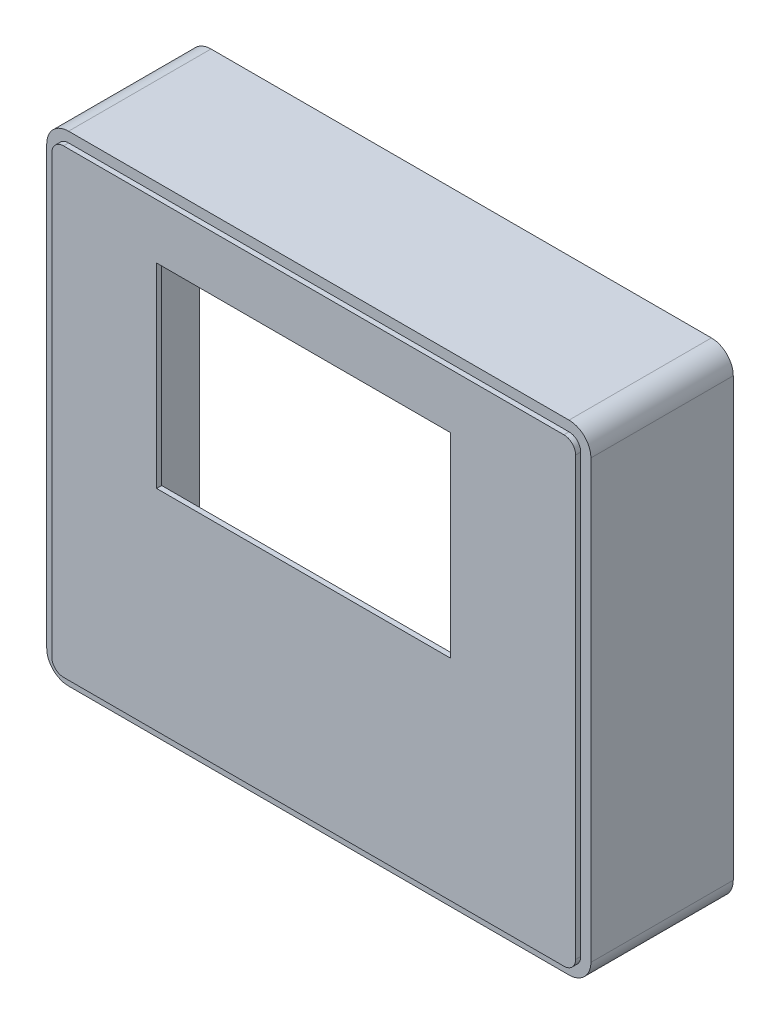
from build123d import *

# Parameters (mm, degrees)
BOSS_EXTRUDE1_DEPTH = 28
SKETCH3_W           = 57.8
SKETCH3_H           = 38.4
BOSS_EXTRUDE2_DEPTH = 28
SKETCH4_W           = 9.3
SKETCH4_H           = 11
SKETCH4_W_2         = 17.696
SKETCH4_H_2         = 6.81
SKETCH4_W_3         = 8.89
SKETCH4_H_3         = 3.43
SKETCH4_W_4         = 14.05
SKETCH4_H_4         = 16.84
CUT_EXTRUDE1_DEPTH  = 2
CUT_EXTRUDE2_DEPTH  = 23
SKETCH6_W           = 57.8
SKETCH6_H           = 38.4
CUT_EXTRUDE5_DEPTH  = 28
SKETCH7_W           = 57.8
SKETCH7_H           = 38.4
BOSS_EXTRUDE3_DEPTH = 28
CUT_EXTRUDE7_DEPTH  = 27


with BuildPart() as part:
    # Sketch2 → Boss-Extrude1 (new body)
    with BuildSketch(Plane.XY):
        with BuildLine():
            Line((-18.7, 47.45), (-18.7, -38.45))
            ThreePointArc((-18.7, -38.45), (-17.440559159, -41.490559159), (-14.4, -42.75))
            Line((-14.4, -42.75), (84, -42.75))
            ThreePointArc((84, -42.75), (87.040559159, -41.490559159), (88.3, -38.45))
            Line((88.3, -38.45), (88.3, 47.45))
            ThreePointArc((88.3, 47.45), (87.040559159, 50.490559159), (84, 51.75))
            Line((84, 51.75), (-14.4, 51.75))
            ThreePointArc((-14.4, 51.75), (-17.440559159, 50.490559159), (-18.7, 47.45))
        make_face()
        with BuildLine():
            Line((84, 49.75), (-14.4, 49.75))
            ThreePointArc((-14.4, 49.75), (-16.026345597, 49.076345597), (-16.7, 47.45))
            Line((-16.7, 47.45), (-16.7, -38.45))
            ThreePointArc((-16.7, -38.45), (-16.026345597, -40.076345597), (-14.4, -40.75))
            Line((-14.4, -40.75), (84, -40.75))
            ThreePointArc((84, -40.75), (85.626345597, -40.076345597), (86.3, -38.45))
            Line((86.3, -38.45), (86.3, 47.45))
            ThreePointArc((86.3, 47.45), (85.626345597, 49.076345597), (84, 49.75))
        make_face(mode=Mode.SUBTRACT)
    extrude(amount=BOSS_EXTRUDE1_DEPTH)

    # Sketch3 → Boss-Extrude2 (add)
    with BuildSketch(Plane.XY):
        with BuildLine():
            Line((-18.7, 47.45), (-18.7, -38.45))
            ThreePointArc((-18.7, -38.45), (-17.440559159, -41.490559159), (-14.4, -42.75))
            Line((-14.4, -42.75), (84, -42.75))
            ThreePointArc((84, -42.75), (87.040559159, -41.490559159), (88.3, -38.45))
            Line((88.3, -38.45), (88.3, 47.45))
            ThreePointArc((88.3, 47.45), (87.040559159, 50.490559159), (84, 51.75))
            Line((84, 51.75), (-14.4, 51.75))
            ThreePointArc((-14.4, 51.75), (-17.440559159, 50.490559159), (-18.7, 47.45))
        make_face()
        with Locations((32.8, 19.76)):
            Rectangle(SKETCH3_W, SKETCH3_H, mode=Mode.SUBTRACT)
    extrude(amount=BOSS_EXTRUDE2_DEPTH)

    # Sketch4 → Cut-Extrude1 (cut)
    with BuildSketch(Plane.XZ.offset(42.75)):
        with Locations((-9.2, 5.47)):
            Rectangle(SKETCH4_W, SKETCH4_H)
        with Locations((7.56, 3.4512)):
            Rectangle(SKETCH4_W_2, SKETCH4_H_2)
        with Locations((76.775, 1.7612)):
            Rectangle(SKETCH4_W_3, SKETCH4_H_3)
        Polygon((66.12, -0.03), (68.12, -0.03), (69.827, -0.03), (69.827, 13.619992795), (68.12, 13.619992795), (66.12, 13.619992795), (57.38, 13.619992795), (55.38, 13.619992795), (53.673, 13.619992795), (53.673, -0.03), (55.38, -0.03), (57.38, -0.03), align=None)
        with Locations((44.4, 8.4662)):
            Rectangle(SKETCH4_W_4, SKETCH4_H_4)
        with Locations((27.4, 8.4662)):
            Rectangle(SKETCH4_W_4, SKETCH4_H_4)
    extrude(amount=-CUT_EXTRUDE1_DEPTH, mode=Mode.SUBTRACT)

    # Sketch5 → Cut-Extrude2 (cut)
    with BuildSketch(Plane.ZY.offset(18.7)):
        with BuildLine():
            Line((26.466, 1.76), (26.466, 4.86))
            ThreePointArc((26.466, 4.86), (26.378132034, 5.072132034), (26.166, 5.16))
            Line((26.166, 5.16), (14.566, 5.16))
            ThreePointArc((14.566, 5.16), (14.353867966, 5.072132034), (14.266, 4.86))
            Line((14.266, 4.86), (14.266, 1.76))
            ThreePointArc((14.266, 1.76), (14.353867966, 1.547867966), (14.566, 1.46))
            Line((14.566, 1.46), (26.166, 1.46))
            ThreePointArc((26.166, 1.46), (26.378132034, 1.547867966), (26.466, 1.76))
        make_face()
        with BuildLine():
            Line((26.166, 9.86), (14.566, 9.86))
            ThreePointArc((14.566, 9.86), (14.353867966, 9.772132034), (14.266, 9.56))
            Line((14.266, 9.56), (14.266, 6.46))
            ThreePointArc((14.266, 6.46), (14.353867966, 6.247867966), (14.566, 6.16))
            Line((14.566, 6.16), (26.166, 6.16))
            ThreePointArc((26.166, 6.16), (26.378132034, 6.247867966), (26.466, 6.46))
            Line((26.466, 6.46), (26.466, 9.56))
            ThreePointArc((26.466, 9.56), (26.378132034, 9.772132034), (26.166, 9.86))
        make_face()
        with BuildLine():
            Line((26.166, 14.56), (14.566, 14.56))
            ThreePointArc((14.566, 14.56), (14.353867966, 14.472132034), (14.266, 14.26))
            Line((14.266, 14.26), (14.266, 11.16))
            ThreePointArc((14.266, 11.16), (14.353867966, 10.947867966), (14.566, 10.86))
            Line((14.566, 10.86), (26.166, 10.86))
            ThreePointArc((26.166, 10.86), (26.378132034, 10.947867966), (26.466, 11.16))
            Line((26.466, 11.16), (26.466, 14.26))
            ThreePointArc((26.466, 14.26), (26.378132034, 14.472132034), (26.166, 14.56))
        make_face()
        with BuildLine():
            Line((26.166, 19.26), (14.566, 19.26))
            ThreePointArc((14.566, 19.26), (14.353867966, 19.172132034), (14.266, 18.96))
            Line((14.266, 18.96), (14.266, 15.86))
            ThreePointArc((14.266, 15.86), (14.353867966, 15.647867966), (14.566, 15.56))
            Line((14.566, 15.56), (26.166, 15.56))
            ThreePointArc((26.166, 15.56), (26.378132034, 15.647867966), (26.466, 15.86))
            Line((26.466, 15.86), (26.466, 18.96))
            ThreePointArc((26.466, 18.96), (26.378132034, 19.172132034), (26.166, 19.26))
        make_face()
        with BuildLine():
            Line((26.166, 23.96), (14.566, 23.96))
            ThreePointArc((14.566, 23.96), (14.353867966, 23.872132034), (14.266, 23.66))
            Line((14.266, 23.66), (14.266, 20.56))
            ThreePointArc((14.266, 20.56), (14.353867966, 20.347867966), (14.566, 20.26))
            Line((14.566, 20.26), (26.166, 20.26))
            ThreePointArc((26.166, 20.26), (26.378132034, 20.347867966), (26.466, 20.56))
            Line((26.466, 20.56), (26.466, 23.66))
            ThreePointArc((26.466, 23.66), (26.378132034, 23.872132034), (26.166, 23.96))
        make_face()
        with BuildLine():
            Line((26.166, 28.66), (14.566, 28.66))
            ThreePointArc((14.566, 28.66), (14.353867966, 28.572132034), (14.266, 28.36))
            Line((14.266, 28.36), (14.266, 25.26))
            ThreePointArc((14.266, 25.26), (14.353867966, 25.047867966), (14.566, 24.96))
            Line((14.566, 24.96), (26.166, 24.96))
            ThreePointArc((26.166, 24.96), (26.378132034, 25.047867966), (26.466, 25.26))
            Line((26.466, 25.26), (26.466, 28.36))
            ThreePointArc((26.466, 28.36), (26.378132034, 28.572132034), (26.166, 28.66))
        make_face()
        with BuildLine():
            Line((26.166, 33.36), (14.566, 33.36))
            ThreePointArc((14.566, 33.36), (14.353867966, 33.272132034), (14.266, 33.06))
            Line((14.266, 33.06), (14.266, 29.96))
            ThreePointArc((14.266, 29.96), (14.353867966, 29.747867966), (14.566, 29.66))
            Line((14.566, 29.66), (26.166, 29.66))
            ThreePointArc((26.166, 29.66), (26.378132034, 29.747867966), (26.466, 29.96))
            Line((26.466, 29.96), (26.466, 33.06))
            ThreePointArc((26.466, 33.06), (26.378132034, 33.272132034), (26.166, 33.36))
        make_face()
        with BuildLine():
            Line((26.166, 38.06), (14.566, 38.06))
            ThreePointArc((14.566, 38.06), (14.353867966, 37.972132034), (14.266, 37.76))
            Line((14.266, 37.76), (14.266, 34.66))
            ThreePointArc((14.266, 34.66), (14.353867966, 34.447867966), (14.566, 34.36))
            Line((14.566, 34.36), (26.166, 34.36))
            ThreePointArc((26.166, 34.36), (26.378132034, 34.447867966), (26.466, 34.66))
            Line((26.466, 34.66), (26.466, 37.76))
            ThreePointArc((26.466, 37.76), (26.378132034, 37.972132034), (26.166, 38.06))
        make_face()
    extrude(amount=-CUT_EXTRUDE2_DEPTH, mode=Mode.SUBTRACT)

    # Sketch6 → Cut-Extrude5 (cut)
    with BuildSketch(Plane.XY.offset(28)):
        with BuildLine():
            Line((84, 49.75), (-14.4, 49.75))
            ThreePointArc((-14.4, 49.75), (-16.026345597, 49.076345597), (-16.7, 47.45))
            Line((-16.7, 47.45), (-16.7, -38.45))
            ThreePointArc((-16.7, -38.45), (-16.026345597, -40.076345597), (-14.4, -40.75))
            Line((-14.4, -40.75), (84, -40.75))
            ThreePointArc((84, -40.75), (85.626345597, -40.076345597), (86.3, -38.45))
            Line((86.3, -38.45), (86.3, 47.45))
            ThreePointArc((86.3, 47.45), (85.626345597, 49.076345597), (84, 49.75))
        make_face()
        with Locations((32.8, 19.76)):
            Rectangle(SKETCH6_W, SKETCH6_H, mode=Mode.SUBTRACT)
    extrude(amount=-CUT_EXTRUDE5_DEPTH, mode=Mode.SUBTRACT)


with BuildPart() as body_2:
    # Sketch7 → Boss-Extrude3 (new body)
    with BuildSketch(Plane.XY.offset(28)):
        with BuildLine():
            Line((86.3, -38.45), (86.3, 47.45))
            ThreePointArc((86.3, 47.45), (85.626345597, 49.076345597), (84, 49.75))
            Line((84, 49.75), (-14.4, 49.75))
            ThreePointArc((-14.4, 49.75), (-16.026345597, 49.076345597), (-16.7, 47.45))
            Line((-16.7, 47.45), (-16.7, -38.45))
            ThreePointArc((-16.7, -38.45), (-16.026345597, -40.076345597), (-14.4, -40.75))
            Line((-14.4, -40.75), (84, -40.75))
            ThreePointArc((84, -40.75), (85.626345597, -40.076345597), (86.3, -38.45))
        make_face()
        with Locations((32.8, 19.76)):
            Rectangle(SKETCH7_W, SKETCH7_H, mode=Mode.SUBTRACT)
    extrude(amount=BOSS_EXTRUDE3_DEPTH)

    # Sketch8 → Cut-Extrude7 (cut)
    with BuildSketch(Plane.XY.offset(56)):
        with BuildLine():
            Line((84, 49.75), (-14.4, 49.75))
            ThreePointArc((-14.4, 49.75), (-16.026345597, 49.076345597), (-16.7, 47.45))
            Line((-16.7, 47.45), (-16.7, -38.45))
            ThreePointArc((-16.7, -38.45), (-16.026345597, -40.076345597), (-14.4, -40.75))
            Line((-14.4, -40.75), (84, -40.75))
            ThreePointArc((84, -40.75), (85.626345597, -40.076345597), (86.3, -38.45))
            Line((86.3, -38.45), (86.3, 47.45))
            ThreePointArc((86.3, 47.45), (85.626345597, 49.076345597), (84, 49.75))
        make_face()
    extrude(amount=-CUT_EXTRUDE7_DEPTH, mode=Mode.SUBTRACT)


solid = Compound([part.part, body_2.part])
